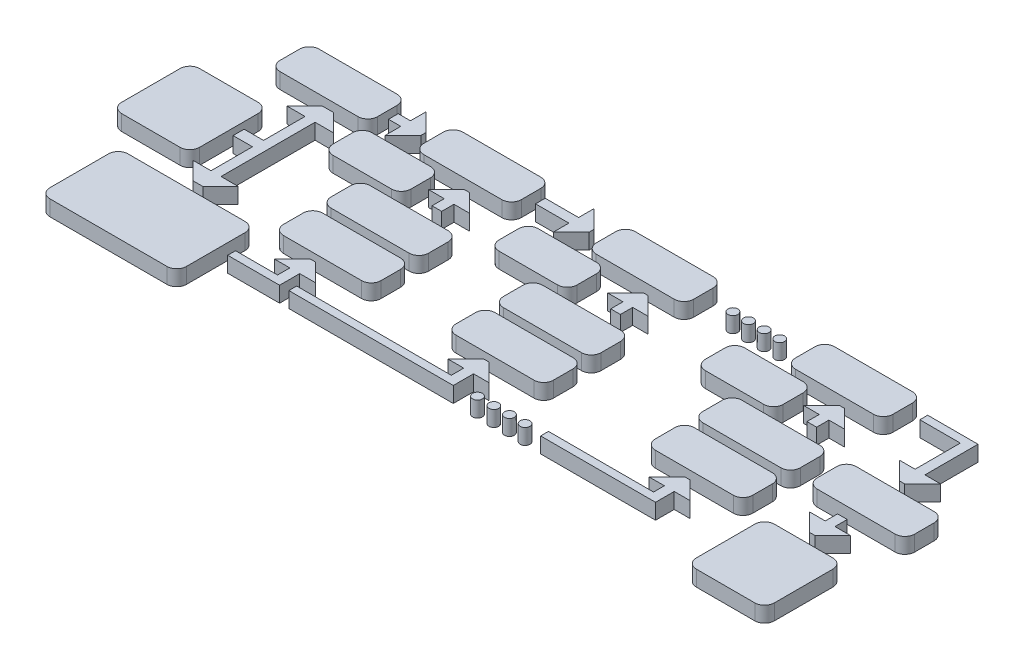
from build123d import *

# Parameters (mm, degrees)
SKETCH3_R              = 0.79375
BOSS_EXTRUDE1_DEPTH    = 2.54
BOSS_EXTRUDE1_2_DEPTH  = 2.54
BOSS_EXTRUDE1_3_DEPTH  = 2.54
BOSS_EXTRUDE1_4_DEPTH  = 2.54
BOSS_EXTRUDE1_5_DEPTH  = 2.54
BOSS_EXTRUDE1_6_DEPTH  = 2.54
BOSS_EXTRUDE1_7_DEPTH  = 2.54
BOSS_EXTRUDE1_8_DEPTH  = 2.54
BOSS_EXTRUDE1_9_DEPTH  = 2.54
BOSS_EXTRUDE1_10_DEPTH = 2.54
BOSS_EXTRUDE1_11_DEPTH = 2.54
BOSS_EXTRUDE1_12_DEPTH = 2.54
BOSS_EXTRUDE1_13_DEPTH = 2.54
BOSS_EXTRUDE1_14_DEPTH = 2.54
BOSS_EXTRUDE1_15_DEPTH = 2.54
BOSS_EXTRUDE1_16_DEPTH = 2.54
BOSS_EXTRUDE1_17_DEPTH = 2.54
BOSS_EXTRUDE1_18_DEPTH = 2.54
BOSS_EXTRUDE1_19_DEPTH = 2.54
BOSS_EXTRUDE1_20_DEPTH = 2.54
BOSS_EXTRUDE1_21_DEPTH = 2.54
BOSS_EXTRUDE1_22_DEPTH = 2.54
BOSS_EXTRUDE1_23_DEPTH = 2.54
BOSS_EXTRUDE1_24_DEPTH = 2.54
BOSS_EXTRUDE1_25_DEPTH = 2.54
BOSS_EXTRUDE1_26_DEPTH = 2.54
BOSS_EXTRUDE1_27_DEPTH = 2.54
BOSS_EXTRUDE1_28_DEPTH = 2.54
BOSS_EXTRUDE1_29_DEPTH = 2.54
BOSS_EXTRUDE1_30_DEPTH = 2.54
BOSS_EXTRUDE1_31_DEPTH = 2.54
BOSS_EXTRUDE1_32_DEPTH = 2.54
BOSS_EXTRUDE1_33_DEPTH = 2.54
BOSS_EXTRUDE1_34_DEPTH = 2.54
BOSS_EXTRUDE1_35_DEPTH = 2.54
BOSS_EXTRUDE1_36_DEPTH = 2.54


with BuildPart() as part:
    # Sketch3 → Boss-Extrude1 (new body)
    with BuildSketch(Plane(origin=(0, 0, 0), x_dir=(1, 0, 0), z_dir=(0, 1, 0))):
        with Locations(Location((12.112574207, 16.553628363, 0), (0, 0, 270))):
            Circle(SKETCH3_R)
    extrude(amount=BOSS_EXTRUDE1_DEPTH)


with BuildPart() as body_2:
    # Sketch3 → Boss-Extrude1 2 (new body)
    with BuildSketch(Plane(origin=(0, 0, 0), x_dir=(1, 0, 0), z_dir=(0, 1, 0))):
        with Locations(Location((14.652574207, 16.553628363, 0), (0, 0, 270))):
            Circle(SKETCH3_R)
    extrude(amount=BOSS_EXTRUDE1_2_DEPTH)


with BuildPart() as body_3:
    # Sketch3 → Boss-Extrude1 3 (new body)
    with BuildSketch(Plane(origin=(0, 0, 0), x_dir=(1, 0, 0), z_dir=(0, 1, 0))):
        with Locations(Location((17.192574207, 16.553628363, 0), (0, 0, 270))):
            Circle(SKETCH3_R)
    extrude(amount=BOSS_EXTRUDE1_3_DEPTH)


with BuildPart() as body_4:
    # Sketch3 → Boss-Extrude1 4 (new body)
    with BuildSketch(Plane(origin=(0, 0, 0), x_dir=(1, 0, 0), z_dir=(0, 1, 0))):
        with Locations(Location((19.732574207, 16.553628363, 0), (0, 0, 270))):
            Circle(SKETCH3_R)
    extrude(amount=BOSS_EXTRUDE1_4_DEPTH)


with BuildPart() as body_5:
    # Sketch3 → Boss-Extrude1 5 (new body)
    with BuildSketch(Plane(origin=(0, 0, 0), x_dir=(1, 0, 0), z_dir=(0, 1, 0))):
        with Locations(Location((3.218203821, -16.148044565, 0), (0, 0, 270))):
            Circle(SKETCH3_R)
    extrude(amount=BOSS_EXTRUDE1_5_DEPTH)


with BuildPart() as body_6:
    # Sketch3 → Boss-Extrude1 6 (new body)
    with BuildSketch(Plane(origin=(0, 0, 0), x_dir=(1, 0, 0), z_dir=(0, 1, 0))):
        with Locations(Location((5.879824927, -16.148044565, 0), (0, 0, 270))):
            Circle(SKETCH3_R)
    extrude(amount=BOSS_EXTRUDE1_6_DEPTH)


with BuildPart() as body_7:
    # Sketch3 → Boss-Extrude1 7 (new body)
    with BuildSketch(Plane(origin=(0, 0, 0), x_dir=(1, 0, 0), z_dir=(0, 1, 0))):
        with Locations(Location((8.419824927, -16.148044565, 0), (0, 0, 270))):
            Circle(SKETCH3_R)
    extrude(amount=BOSS_EXTRUDE1_7_DEPTH)


with BuildPart() as body_8:
    # Sketch3 → Boss-Extrude1 8 (new body)
    with BuildSketch(Plane(origin=(0, 0, 0), x_dir=(1, 0, 0), z_dir=(0, 1, 0))):
        with Locations(Location((10.959824927, -16.148044565, 0), (0, 0, 270))):
            Circle(SKETCH3_R)
    extrude(amount=BOSS_EXTRUDE1_8_DEPTH)


with BuildPart() as body_9:
    # Sketch3 → Boss-Extrude1 9 (new body)
    with BuildSketch(Plane(origin=(0, 0, 0), x_dir=(1, 0, 0), z_dir=(0, 1, 0))):
        with BuildLine():
            Line((-7.137759864, 13.542454265), (5.562240136, 13.542454265))
            ThreePointArc((5.562240136, 13.542454265), (6.684772151, 14.00742225), (7.149740136, 15.129954265))
            Line((7.149740136, 15.129954265), (7.149740136, 18.304954265))
            ThreePointArc((7.149740136, 18.304954265), (6.684772151, 19.42748628), (5.562240136, 19.892454265))
            Line((5.562240136, 19.892454265), (-7.137759864, 19.892454265))
            ThreePointArc((-7.137759864, 19.892454265), (-8.260291879, 19.42748628), (-8.725259864, 18.304954265))
            Line((-8.725259864, 18.304954265), (-8.725259864, 15.129954265))
            ThreePointArc((-8.725259864, 15.129954265), (-8.260291879, 14.00742225), (-7.137759864, 13.542454265))
        make_face()
    extrude(amount=BOSS_EXTRUDE1_9_DEPTH)


with BuildPart() as body_10:
    # Sketch3 → Boss-Extrude1 10 (new body)
    with BuildSketch(Plane(origin=(0, 0, 0), x_dir=(1, 0, 0), z_dir=(0, 1, 0))):
        with BuildLine():
            Line((-58.63155616, 13.542454265), (-45.93155616, 13.542454265))
            ThreePointArc((-45.93155616, 13.542454265), (-44.809024145, 14.00742225), (-44.34405616, 15.129954265))
            Line((-44.34405616, 15.129954265), (-44.34405616, 18.304954265))
            ThreePointArc((-44.34405616, 18.304954265), (-44.809024145, 19.42748628), (-45.93155616, 19.892454265))
            Line((-45.93155616, 19.892454265), (-58.63155616, 19.892454265))
            ThreePointArc((-58.63155616, 19.892454265), (-59.754088175, 19.42748628), (-60.21905616, 18.304954265))
            Line((-60.21905616, 18.304954265), (-60.21905616, 15.129954265))
            ThreePointArc((-60.21905616, 15.129954265), (-59.754088175, 14.00742225), (-58.63155616, 13.542454265))
        make_face()
    extrude(amount=BOSS_EXTRUDE1_10_DEPTH)


with BuildPart() as body_11:
    # Sketch3 → Boss-Extrude1 11 (new body)
    with BuildSketch(Plane(origin=(0, 0, 0), x_dir=(1, 0, 0), z_dir=(0, 1, 0))):
        with BuildLine():
            Line((-35.218870975, 13.542454265), (-22.518870975, 13.542454265))
            ThreePointArc((-22.518870975, 13.542454265), (-21.39633896, 14.00742225), (-20.931370975, 15.129954265))
            Line((-20.931370975, 15.129954265), (-20.931370975, 18.304954265))
            ThreePointArc((-20.931370975, 18.304954265), (-21.39633896, 19.42748628), (-22.518870975, 19.892454265))
            Line((-22.518870975, 19.892454265), (-35.218870975, 19.892454265))
            ThreePointArc((-35.218870975, 19.892454265), (-36.34140299, 19.42748628), (-36.806370975, 18.304954265))
            Line((-36.806370975, 18.304954265), (-36.806370975, 15.129954265))
            ThreePointArc((-36.806370975, 15.129954265), (-36.34140299, 14.00742225), (-35.218870975, 13.542454265))
        make_face()
    extrude(amount=BOSS_EXTRUDE1_11_DEPTH)


with BuildPart() as body_12:
    # Sketch3 → Boss-Extrude1 12 (new body)
    with BuildSketch(Plane(origin=(0, 0, 0), x_dir=(1, 0, 0), z_dir=(0, 1, 0))):
        with BuildLine():
            Line((-35.218870975, -1.552222222), (-22.518870975, -1.552222222))
            ThreePointArc((-22.518870975, -1.552222222), (-21.39633896, -1.087254237), (-20.931370975, 0.035277778))
            Line((-20.931370975, 0.035277778), (-20.931370975, 3.210277778))
            ThreePointArc((-20.931370975, 3.210277778), (-21.39633896, 4.332809793), (-22.518870975, 4.797777778))
            Line((-22.518870975, 4.797777778), (-35.218870975, 4.797777778))
            ThreePointArc((-35.218870975, 4.797777778), (-36.34140299, 4.332809793), (-36.806370975, 3.210277778))
            Line((-36.806370975, 3.210277778), (-36.806370975, 0.035277778))
            ThreePointArc((-36.806370975, 0.035277778), (-36.34140299, -1.087254237), (-35.218870975, -1.552222222))
        make_face()
    extrude(amount=BOSS_EXTRUDE1_12_DEPTH)


with BuildPart() as body_13:
    # Sketch3 → Boss-Extrude1 13 (new body)
    with BuildSketch(Plane(origin=(0, 0, 0), x_dir=(1, 0, 0), z_dir=(0, 1, 0))):
        with BuildLine():
            Line((25.317795692, 13.542454265), (38.017795692, 13.542454265))
            ThreePointArc((38.017795692, 13.542454265), (39.140327707, 14.00742225), (39.605295692, 15.129954265))
            Line((39.605295692, 15.129954265), (39.605295692, 18.304954265))
            ThreePointArc((39.605295692, 18.304954265), (39.140327707, 19.42748628), (38.017795692, 19.892454265))
            Line((38.017795692, 19.892454265), (25.317795692, 19.892454265))
            ThreePointArc((25.317795692, 19.892454265), (24.195263676, 19.42748628), (23.730295692, 18.304954265))
            Line((23.730295692, 18.304954265), (23.730295692, 15.129954265))
            ThreePointArc((23.730295692, 15.129954265), (24.195263676, 14.00742225), (25.317795692, 13.542454265))
        make_face()
    extrude(amount=BOSS_EXTRUDE1_13_DEPTH)


with BuildPart() as body_14:
    # Sketch3 → Boss-Extrude1 14 (new body)
    with BuildSketch(Plane(origin=(0, 0, 0), x_dir=(1, 0, 0), z_dir=(0, 1, 0))):
        with BuildLine():
            Line((-7.137759864, -1.552222222), (5.562240136, -1.552222222))
            ThreePointArc((5.562240136, -1.552222222), (6.684772151, -1.087254237), (7.149740136, 0.035277778))
            Line((7.149740136, 0.035277778), (7.149740136, 3.210277778))
            ThreePointArc((7.149740136, 3.210277778), (6.684772151, 4.332809793), (5.562240136, 4.797777778))
            Line((5.562240136, 4.797777778), (-7.137759864, 4.797777778))
            ThreePointArc((-7.137759864, 4.797777778), (-8.260291879, 4.332809793), (-8.725259864, 3.210277778))
            Line((-8.725259864, 3.210277778), (-8.725259864, 0.035277778))
            ThreePointArc((-8.725259864, 0.035277778), (-8.260291879, -1.087254237), (-7.137759864, -1.552222222))
        make_face()
    extrude(amount=BOSS_EXTRUDE1_14_DEPTH)


with BuildPart() as body_15:
    # Sketch3 → Boss-Extrude1 15 (new body)
    with BuildSketch(Plane(origin=(0, 0, 0), x_dir=(1, 0, 0), z_dir=(0, 1, 0))):
        with BuildLine():
            Line((25.317795692, -1.552222222), (38.017795692, -1.552222222))
            ThreePointArc((38.017795692, -1.552222222), (39.140327707, -1.087254237), (39.605295692, 0.035277778))
            Line((39.605295692, 0.035277778), (39.605295692, 3.210277778))
            ThreePointArc((39.605295692, 3.210277778), (39.140327707, 4.332809793), (38.017795692, 4.797777778))
            Line((38.017795692, 4.797777778), (25.317795692, 4.797777778))
            ThreePointArc((25.317795692, 4.797777778), (24.195263676, 4.332809793), (23.730295692, 3.210277778))
            Line((23.730295692, 3.210277778), (23.730295692, 0.035277778))
            ThreePointArc((23.730295692, 0.035277778), (24.195263676, -1.087254237), (25.317795692, -1.552222222))
        make_face()
    extrude(amount=BOSS_EXTRUDE1_15_DEPTH)


with BuildPart() as body_16:
    # Sketch3 → Boss-Extrude1 16 (new body)
    with BuildSketch(Plane(origin=(0, 0, 0), x_dir=(1, 0, 0), z_dir=(0, 1, 0))):
        with BuildLine():
            Line((43.98921107, -1.595825484), (56.68921107, -1.595825484))
            ThreePointArc((56.68921107, -1.595825484), (57.811743085, -1.130857499), (58.27671107, -0.008325484))
            Line((58.27671107, -0.008325484), (58.27671107, 3.166674516))
            ThreePointArc((58.27671107, 3.166674516), (57.811743085, 4.289206531), (56.68921107, 4.754174516))
            Line((56.68921107, 4.754174516), (43.98921107, 4.754174516))
            ThreePointArc((43.98921107, 4.754174516), (42.866679055, 4.289206531), (42.40171107, 3.166674516))
            Line((42.40171107, 3.166674516), (42.40171107, -0.008325484))
            ThreePointArc((42.40171107, -0.008325484), (42.866679055, -1.130857499), (43.98921107, -1.595825484))
        make_face()
    extrude(amount=BOSS_EXTRUDE1_16_DEPTH)


with BuildPart() as body_17:
    # Sketch3 → Boss-Extrude1 17 (new body)
    with BuildSketch(Plane(origin=(0, 0, 0), x_dir=(1, 0, 0), z_dir=(0, 1, 0))):
        with BuildLine():
            Line((-35.218870975, -9.293876379), (-22.518870975, -9.293876379))
            ThreePointArc((-22.518870975, -9.293876379), (-21.39633896, -8.828908395), (-20.931370975, -7.706376379))
            Line((-20.931370975, -7.706376379), (-20.931370975, -4.531376379))
            ThreePointArc((-20.931370975, -4.531376379), (-21.39633896, -3.408844364), (-22.518870975, -2.943876379))
            Line((-22.518870975, -2.943876379), (-35.218870975, -2.943876379))
            ThreePointArc((-35.218870975, -2.943876379), (-36.34140299, -3.408844364), (-36.806370975, -4.531376379))
            Line((-36.806370975, -4.531376379), (-36.806370975, -7.706376379))
            ThreePointArc((-36.806370975, -7.706376379), (-36.34140299, -8.828908395), (-35.218870975, -9.293876379))
        make_face()
    extrude(amount=BOSS_EXTRUDE1_17_DEPTH)


with BuildPart() as body_18:
    # Sketch3 → Boss-Extrude1 18 (new body)
    with BuildSketch(Plane(origin=(0, 0, 0), x_dir=(1, 0, 0), z_dir=(0, 1, 0))):
        with BuildLine():
            Line((-7.137759864, -9.293876379), (5.562240136, -9.293876379))
            ThreePointArc((5.562240136, -9.293876379), (6.684772151, -8.828908395), (7.149740136, -7.706376379))
            Line((7.149740136, -7.706376379), (7.149740136, -4.531376379))
            ThreePointArc((7.149740136, -4.531376379), (6.684772151, -3.408844364), (5.562240136, -2.943876379))
            Line((5.562240136, -2.943876379), (-7.137759864, -2.943876379))
            ThreePointArc((-7.137759864, -2.943876379), (-8.260291879, -3.408844364), (-8.725259864, -4.531376379))
            Line((-8.725259864, -4.531376379), (-8.725259864, -7.706376379))
            ThreePointArc((-8.725259864, -7.706376379), (-8.260291879, -8.828908395), (-7.137759864, -9.293876379))
        make_face()
    extrude(amount=BOSS_EXTRUDE1_18_DEPTH)


with BuildPart() as body_19:
    # Sketch3 → Boss-Extrude1 19 (new body)
    with BuildSketch(Plane(origin=(0, 0, 0), x_dir=(1, 0, 0), z_dir=(0, 1, 0))):
        with BuildLine():
            Line((25.317795692, -9.293876379), (38.017795692, -9.293876379))
            ThreePointArc((38.017795692, -9.293876379), (39.140327707, -8.828908395), (39.605295692, -7.706376379))
            Line((39.605295692, -7.706376379), (39.605295692, -4.531376379))
            ThreePointArc((39.605295692, -4.531376379), (39.140327707, -3.408844364), (38.017795692, -2.943876379))
            Line((38.017795692, -2.943876379), (25.317795692, -2.943876379))
            ThreePointArc((25.317795692, -2.943876379), (24.195263676, -3.408844364), (23.730295692, -4.531376379))
            Line((23.730295692, -4.531376379), (23.730295692, -7.706376379))
            ThreePointArc((23.730295692, -7.706376379), (24.195263676, -8.828908395), (25.317795692, -9.293876379))
        make_face()
    extrude(amount=BOSS_EXTRUDE1_19_DEPTH)


with BuildPart() as body_20:
    # Sketch3 → Boss-Extrude1 20 (new body)
    with BuildSketch(Plane(origin=(0, 0, 0), x_dir=(1, 0, 0), z_dir=(0, 1, 0))):
        with BuildLine():
            Line((-42.520153906, 6.057722912), (-32.995153906, 6.057722912))
            ThreePointArc((-32.995153906, 6.057722912), (-31.87262189, 6.522690896), (-31.407653906, 7.645222912))
            Line((-31.407653906, 7.645222912), (-31.407653906, 10.820222912))
            ThreePointArc((-31.407653906, 10.820222912), (-31.87262189, 11.942754927), (-32.995153906, 12.407722912))
            Line((-32.995153906, 12.407722912), (-42.520153906, 12.407722912))
            ThreePointArc((-42.520153906, 12.407722912), (-43.642685921, 11.942754927), (-44.107653906, 10.820222912))
            Line((-44.107653906, 10.820222912), (-44.107653906, 7.645222912))
            ThreePointArc((-44.107653906, 7.645222912), (-43.642685921, 6.522690896), (-42.520153906, 6.057722912))
        make_face()
    extrude(amount=BOSS_EXTRUDE1_20_DEPTH)


with BuildPart() as body_21:
    # Sketch3 → Boss-Extrude1 21 (new body)
    with BuildSketch(Plane(origin=(0, 0, 0), x_dir=(1, 0, 0), z_dir=(0, 1, 0))):
        with BuildLine():
            Line((-40.362734536, -23.139610357), (-59.412734536, -23.139610357))
            ThreePointArc((-59.412734536, -23.139610357), (-60.535266551, -22.674642372), (-61.000234536, -21.552110357))
            Line((-61.000234536, -21.552110357), (-61.000234536, -12.027110357))
            ThreePointArc((-61.000234536, -12.027110357), (-60.535266551, -10.904578341), (-59.412734536, -10.439610357))
            Line((-59.412734536, -10.439610357), (-40.362734536, -10.439610357))
            ThreePointArc((-40.362734536, -10.439610357), (-39.240202521, -10.904578341), (-38.775234536, -12.027110357))
            Line((-38.775234536, -12.027110357), (-38.775234536, -21.552110357))
            ThreePointArc((-38.775234536, -21.552110357), (-39.240202521, -22.674642372), (-40.362734536, -23.139610357))
        make_face()
    extrude(amount=BOSS_EXTRUDE1_21_DEPTH)


with BuildPart() as body_22:
    # Sketch3 → Boss-Extrude1 22 (new body)
    with BuildSketch(Plane(origin=(0, 0, 0), x_dir=(1, 0, 0), z_dir=(0, 1, 0))):
        with BuildLine():
            Line((-15.473458795, 6.057722912), (-5.948458795, 6.057722912))
            ThreePointArc((-5.948458795, 6.057722912), (-4.82592678, 6.522690896), (-4.360958795, 7.645222912))
            Line((-4.360958795, 7.645222912), (-4.360958795, 10.820222912))
            ThreePointArc((-4.360958795, 10.820222912), (-4.82592678, 11.942754927), (-5.948458795, 12.407722912))
            Line((-5.948458795, 12.407722912), (-15.473458795, 12.407722912))
            ThreePointArc((-15.473458795, 12.407722912), (-16.59599081, 11.942754927), (-17.060958795, 10.820222912))
            Line((-17.060958795, 10.820222912), (-17.060958795, 7.645222912))
            ThreePointArc((-17.060958795, 7.645222912), (-16.59599081, 6.522690896), (-15.473458795, 6.057722912))
        make_face()
    extrude(amount=BOSS_EXTRUDE1_22_DEPTH)


with BuildPart() as body_23:
    # Sketch3 → Boss-Extrude1 23 (new body)
    with BuildSketch(Plane(origin=(0, 0, 0), x_dir=(1, 0, 0), z_dir=(0, 1, 0))):
        with BuildLine():
            Line((18.15867076, 6.00267851), (27.68367076, 6.00267851))
            ThreePointArc((27.68367076, 6.00267851), (28.806202775, 6.467646495), (29.27117076, 7.59017851))
            Line((29.27117076, 7.59017851), (29.27117076, 10.820222912))
            ThreePointArc((29.27117076, 10.820222912), (28.806202775, 11.942754927), (27.68367076, 12.407722912))
            Line((27.68367076, 12.407722912), (18.15867076, 12.407722912))
            ThreePointArc((18.15867076, 12.407722912), (17.036138745, 11.942754927), (16.57117076, 10.820222912))
            Line((16.57117076, 10.820222912), (16.57117076, 7.59017851))
            ThreePointArc((16.57117076, 7.59017851), (17.036138745, 6.467646495), (18.15867076, 6.00267851))
        make_face()
    extrude(amount=BOSS_EXTRUDE1_23_DEPTH)


with BuildPart() as body_24:
    # Sketch3 → Boss-Extrude1 24 (new body)
    with BuildSketch(Plane(origin=(0, 0, 0), x_dir=(1, 0, 0), z_dir=(0, 1, 0))):
        with BuildLine():
            Line((45.44214722, -22.729174298), (54.96714722, -22.729174298))
            ThreePointArc((54.96714722, -22.729174298), (56.089679235, -22.264206313), (56.55464722, -21.141674298))
            Line((56.55464722, -21.141674298), (56.55464722, -11.616674298))
            ThreePointArc((56.55464722, -11.616674298), (56.089679235, -10.494142283), (54.96714722, -10.029174298))
            Line((54.96714722, -10.029174298), (45.44214722, -10.029174298))
            ThreePointArc((45.44214722, -10.029174298), (44.319615205, -10.494142283), (43.85464722, -11.616674298))
            Line((43.85464722, -11.616674298), (43.85464722, -21.141674298))
            ThreePointArc((43.85464722, -21.141674298), (44.319615205, -22.264206313), (45.44214722, -22.729174298))
        make_face()
    extrude(amount=BOSS_EXTRUDE1_24_DEPTH)


with BuildPart() as body_25:
    # Sketch3 → Boss-Extrude1 25 (new body)
    with BuildSketch(Plane(origin=(0, 0, 0), x_dir=(1, 0, 0), z_dir=(0, 1, 0))):
        with BuildLine():
            Line((-65.618540047, -5.2757465), (-56.093540047, -5.2757465))
            ThreePointArc((-56.093540047, -5.2757465), (-54.971008032, -4.810778515), (-54.506040047, -3.6882465))
            Line((-54.506040047, -3.6882465), (-54.506040047, 5.8367535))
            ThreePointArc((-54.506040047, 5.8367535), (-54.971008032, 6.959285515), (-56.093540047, 7.4242535))
            Line((-56.093540047, 7.4242535), (-65.618540047, 7.4242535))
            ThreePointArc((-65.618540047, 7.4242535), (-66.741072062, 6.959285515), (-67.206040047, 5.8367535))
            Line((-67.206040047, 5.8367535), (-67.206040047, -3.6882465))
            ThreePointArc((-67.206040047, -3.6882465), (-66.741072062, -4.810778515), (-65.618540047, -5.2757465))
        make_face()
    extrude(amount=BOSS_EXTRUDE1_25_DEPTH)


with BuildPart() as body_26:
    # Sketch3 → Boss-Extrude1 26 (new body)
    with BuildSketch(Plane(origin=(0, 0, 0), x_dir=(1, 0, 0), z_dir=(0, 1, 0))):
        Polygon((-28.923281561, -10.427508319), (-26.005590172, -13.345199708), (-28.541768606, -13.345199708), (-28.541768606, -16.622893574), (-36.989080371, -16.622893574), (-36.989080371, -15.344613158), (-30.144235768, -15.344613158), (-30.144235768, -13.345199708), (-32.680414202, -13.345199708), (-29.762722813, -10.427508319), align=None)
    extrude(amount=BOSS_EXTRUDE1_26_DEPTH)


with BuildPart() as body_27:
    # Sketch3 → Boss-Extrude1 27 (new body)
    with BuildSketch(Plane(origin=(0, 0, 0), x_dir=(1, 0, 0), z_dir=(0, 1, 0))):
        Polygon((-0.636052761, -10.403106912), (2.281638628, -13.320798301), (-0.254539806, -13.320798301), (-0.254539806, -16.622893574), (-27.032511206, -16.622893574), (-27.032511206, -15.344613158), (-1.857006968, -15.344613158), (-1.857006968, -13.320798301), (-4.393185402, -13.320798301), (-1.475494013, -10.403106912), align=None)
    extrude(amount=BOSS_EXTRUDE1_27_DEPTH)


with BuildPart() as body_28:
    # Sketch3 → Boss-Extrude1 28 (new body)
    with BuildSketch(Plane(origin=(0, 0, 0), x_dir=(1, 0, 0), z_dir=(0, 1, 0))):
        Polygon((-26.140484459, 11.913038317), (-23.22279307, 8.995346928), (-25.758971504, 8.995346928), (-25.758971504, 6.995933478), (-27.335167092, 6.995933478), (-27.335167092, 8.995346928), (-29.871345526, 8.995346928), (-26.953654137, 11.913038317), align=None)
    extrude(amount=BOSS_EXTRUDE1_28_DEPTH)


with BuildPart() as body_29:
    # Sketch3 → Boss-Extrude1 29 (new body)
    with BuildSketch(Plane(origin=(0, 0, 0), x_dir=(1, 0, 0), z_dir=(0, 1, 0))):
        Polygon((2.952831631, 11.923859662), (5.87052302, 9.006168273), (3.334344586, 9.006168273), (3.334344586, 7.006754823), (1.758148998, 7.006754823), (1.758148998, 9.006168273), (-0.778029435, 9.006168273), (2.139661954, 11.923859662), align=None)
    extrude(amount=BOSS_EXTRUDE1_29_DEPTH)


with BuildPart() as body_30:
    # Sketch3 → Boss-Extrude1 30 (new body)
    with BuildSketch(Plane(origin=(0, 0, 0), x_dir=(1, 0, 0), z_dir=(0, 1, 0))):
        Polygon((-38.158821217, 16.034745059), (-41.076512606, 13.11705367), (-41.076512606, 15.653232104), (-43.075926057, 15.653232104), (-43.075926057, 17.229427692), (-41.076512606, 17.229427692), (-41.076512606, 19.765606126), (-38.158821217, 16.847914737), align=None)
    extrude(amount=BOSS_EXTRUDE1_30_DEPTH)


with BuildPart() as body_31:
    # Sketch3 → Boss-Extrude1 31 (new body)
    with BuildSketch(Plane(origin=(0, 0, 0), x_dir=(1, 0, 0), z_dir=(0, 1, 0))):
        Polygon((-10.823238818, 16.078446325), (-13.740930207, 13.160754936), (-13.740930207, 15.69693337), (-19.177778691, 15.69693337), (-19.177778691, 17.273128958), (-13.740930207, 17.273128958), (-13.740930207, 19.809307392), (-10.823238818, 16.891616003), align=None)
    extrude(amount=BOSS_EXTRUDE1_31_DEPTH)


with BuildPart() as body_32:
    # Sketch3 → Boss-Extrude1 32 (new body)
    with BuildSketch(Plane(origin=(0, 0, 0), x_dir=(1, 0, 0), z_dir=(0, 1, 0))):
        Polygon((-48.548456954, 12.131702461), (-45.669913541, 9.253159048), (-48.642932883, 9.253159048), (-48.642932883, -6.060954226), (-45.857935442, -6.060954226), (-48.736478855, -8.939497639), (-50.321172947, -8.939497639), (-53.19971636, -6.060954226), (-50.272696869, -6.060954226), (-50.272696869, 0.697421463), (-53.432781917, 0.697421463), (-53.432781917, 2.494783359), (-50.272696869, 2.494783359), (-50.272696869, 9.253159048), (-53.24571621, 9.253159048), (-50.367172798, 12.131702461), align=None)
    extrude(amount=BOSS_EXTRUDE1_32_DEPTH)


with BuildPart() as body_33:
    # Sketch3 → Boss-Extrude1 33 (new body)
    with BuildSketch(Plane(origin=(0, 0, 0), x_dir=(1, 0, 0), z_dir=(0, 1, 0))):
        Polygon((32.303234642, -10.656790066), (35.220926031, -13.574481455), (32.684747598, -13.574481455), (32.684747598, -16.622893574), (13.971149676, -16.622893574), (13.971149676, -15.344613158), (31.082280435, -15.344613158), (31.082280435, -13.574481455), (28.546102001, -13.574481455), (31.46379339, -10.656790066), align=None)
    extrude(amount=BOSS_EXTRUDE1_33_DEPTH)


with BuildPart() as body_34:
    # Sketch3 → Boss-Extrude1 34 (new body)
    with BuildSketch(Plane(origin=(0, 0, 0), x_dir=(1, 0, 0), z_dir=(0, 1, 0))):
        Polygon((49.498720464, -8.32588046), (46.60931614, -5.436476136), (49.145494573, -5.436476136), (49.145494573, -3.437062685), (50.721690161, -3.437062685), (50.721690161, -5.436476136), (53.257868595, -5.436476136), (50.368464271, -8.32588046), align=None)
    extrude(amount=BOSS_EXTRUDE1_34_DEPTH)


with BuildPart() as body_35:
    # Sketch3 → Boss-Extrude1 35 (new body)
    with BuildSketch(Plane(origin=(0, 0, 0), x_dir=(1, 0, 0), z_dir=(0, 1, 0))):
        Polygon((34.830783338, 12.00575623), (37.748474727, 9.088064841), (35.212296293, 9.088064841), (35.212296293, 7.088651391), (33.636100705, 7.088651391), (33.636100705, 9.088064841), (31.099922271, 9.088064841), (34.01761366, 12.00575623), align=None)
    extrude(amount=BOSS_EXTRUDE1_35_DEPTH)


with BuildPart() as body_36:
    # Sketch3 → Boss-Extrude1 36 (new body)
    with BuildSketch(Plane(origin=(0, 0, 0), x_dir=(1, 0, 0), z_dir=(0, 1, 0))):
        Polygon((50.760983928, 17.820293935), (42.568765017, 17.820293935), (42.568765017, 16.542013519), (49.158516765, 16.542013519), (49.158516765, 9.17590319), (46.622338331, 9.17590319), (49.54002972, 6.258211801), (50.379470972, 6.258211801), (53.297162361, 9.17590319), (50.760983928, 9.17590319), align=None)
    extrude(amount=BOSS_EXTRUDE1_36_DEPTH)


solid = Compound([part.part, body_2.part, body_3.part, body_4.part, body_5.part, body_6.part, body_7.part, body_8.part, body_9.part, body_10.part, body_11.part, body_12.part, body_13.part, body_14.part, body_15.part, body_16.part, body_17.part, body_18.part, body_19.part, body_20.part, body_21.part, body_22.part, body_23.part, body_24.part, body_25.part, body_26.part, body_27.part, body_28.part, body_29.part, body_30.part, body_31.part, body_32.part, body_33.part, body_34.part, body_35.part, body_36.part])
